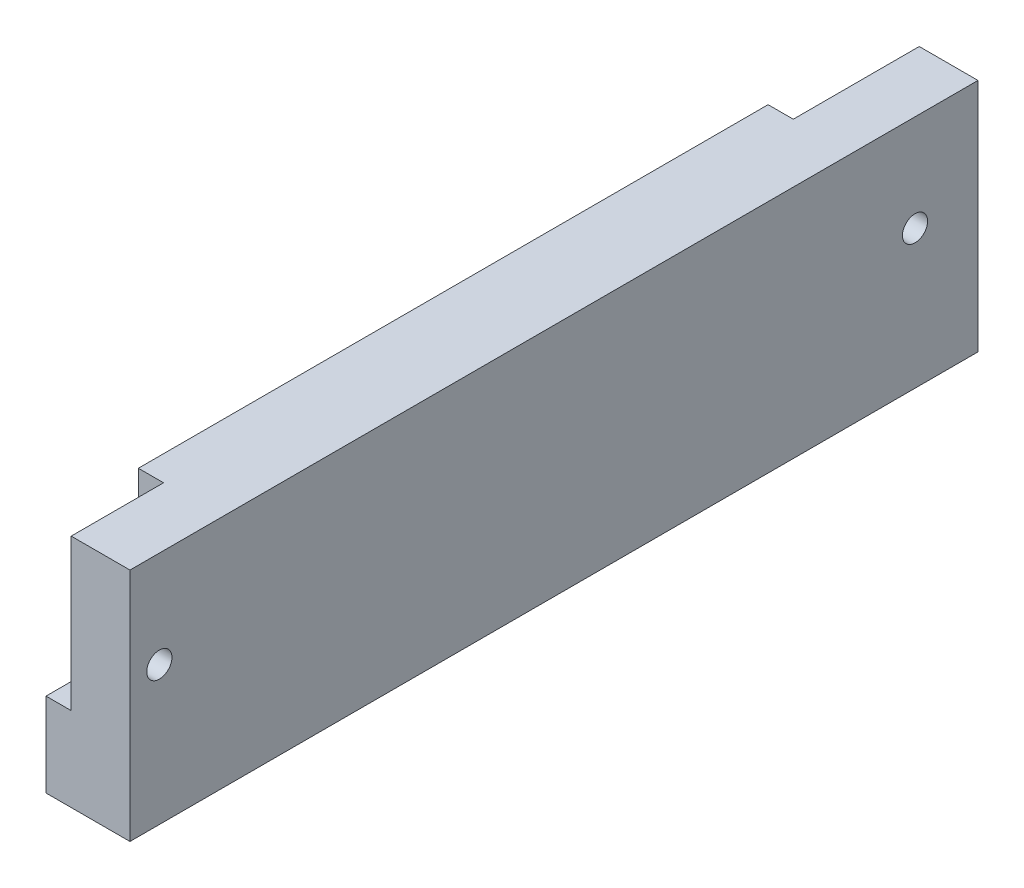
from build123d import *

# Parameters (mm, degrees)
SKETCH_1_W          = 10
SKETCH_1_H          = 28
EXTRUDE_1_DEPTH     = 105
SKETCH_2_R          = 1.5
CUT_EXTRUDE_1_DEPTH = 10
SKETCH_3_R          = 1.5
CUT_EXTRUDE_2_DEPTH = 107.40018797
SKETCH_4_W          = 15
SKETCH_4_H          = 18
CUT_EXTRUDE_3_DEPTH = 3
SKETCH_5_W          = 19.297402577
SKETCH_5_H          = 33.931864009
CUT_EXTRUDE_6_DEPTH = 4


with BuildPart() as part:
    # 草图1 → 凸台-拉伸1 (new body)
    with BuildSketch(Plane.XY):
        Rectangle(SKETCH_1_W, SKETCH_1_H)
    extrude(amount=EXTRUDE_1_DEPTH)

    # 草图2 → 切除-拉伸1 (cut)
    with BuildSketch(Plane.XZ.offset(14)):
        with Locations(Location((0, 97.5, 0), (0, 0, 270))):
            Circle(SKETCH_2_R)
        with Locations(Location((0, 7.5, 0), (0, 0, 270))):
            Circle(SKETCH_2_R)
    extrude(amount=-CUT_EXTRUDE_1_DEPTH, mode=Mode.SUBTRACT)

    # 草图3 → 切除-拉伸2 (cut, through all)
    with BuildSketch(Plane.ZY.offset(5)):
        with Locations(Location((7.5, 2.5, 0), (0, 0, 270))):
            Circle(SKETCH_3_R)
        with Locations(Location((97.5, 2.5, 0), (0, 0, 270))):
            Circle(SKETCH_3_R)
    extrude(amount=-CUT_EXTRUDE_2_DEPTH, mode=Mode.SUBTRACT)

    # 草图4 → 切除-拉伸3 (cut)
    with BuildSketch(Plane.ZY.offset(5)):
        with Locations((7.5, 5)):
            Rectangle(SKETCH_4_W, SKETCH_4_H)
        with Locations((97.5, 5)):
            Rectangle(SKETCH_4_W, SKETCH_4_H)
    extrude(amount=-CUT_EXTRUDE_3_DEPTH, mode=Mode.SUBTRACT)

    # 草图5 → 切除-拉伸6 (cut)
    with BuildSketch(Plane.XY.offset(105)):
        with Locations((1.058128951, -0.39887643)):
            Rectangle(SKETCH_5_W, SKETCH_5_H)
    extrude(amount=-CUT_EXTRUDE_6_DEPTH, mode=Mode.SUBTRACT)


solid = part.part
